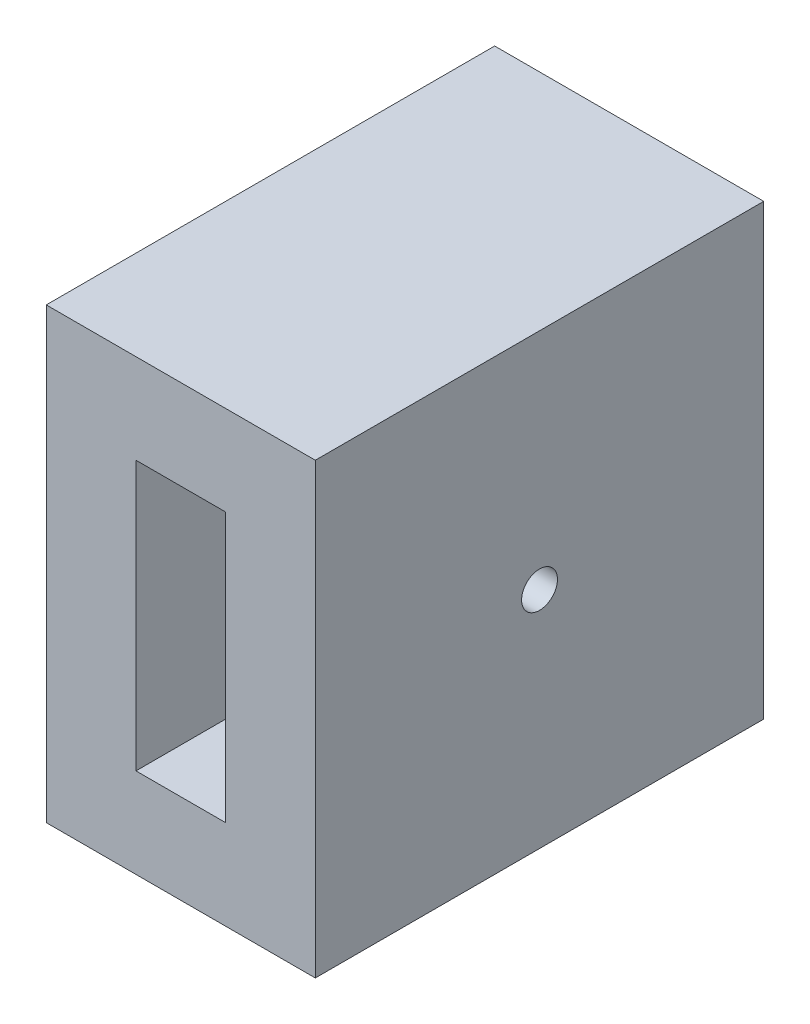
from build123d import *

# Parameters (mm, degrees)
SKETCH1_W           = 30
SKETCH1_H           = 50
SKETCH1_W_2         = 10
SKETCH1_H_2         = 30
BOSS_EXTRUDE2_DEPTH = 50
SKETCH2_R           = 2
CUT_EXTRUDE1_DEPTH  = 10


with BuildPart() as part:
    # Sketch1 → Boss-Extrude2 (new body)
    with BuildSketch(Plane.XY):
        Rectangle(SKETCH1_W, SKETCH1_H)
        Rectangle(SKETCH1_W_2, SKETCH1_H_2, mode=Mode.SUBTRACT)
    extrude(amount=BOSS_EXTRUDE2_DEPTH)

    # Sketch2 → Cut-Extrude1 (cut)
    with BuildSketch(Plane(origin=(15, 0, 0), x_dir=(0, 0, -1), z_dir=(1, 0, 0))):
        with Locations(Location((-25, 0, 0), (0, 0, 90))):
            Circle(SKETCH2_R)
    extrude(amount=-CUT_EXTRUDE1_DEPTH, mode=Mode.SUBTRACT)


solid = part.part
